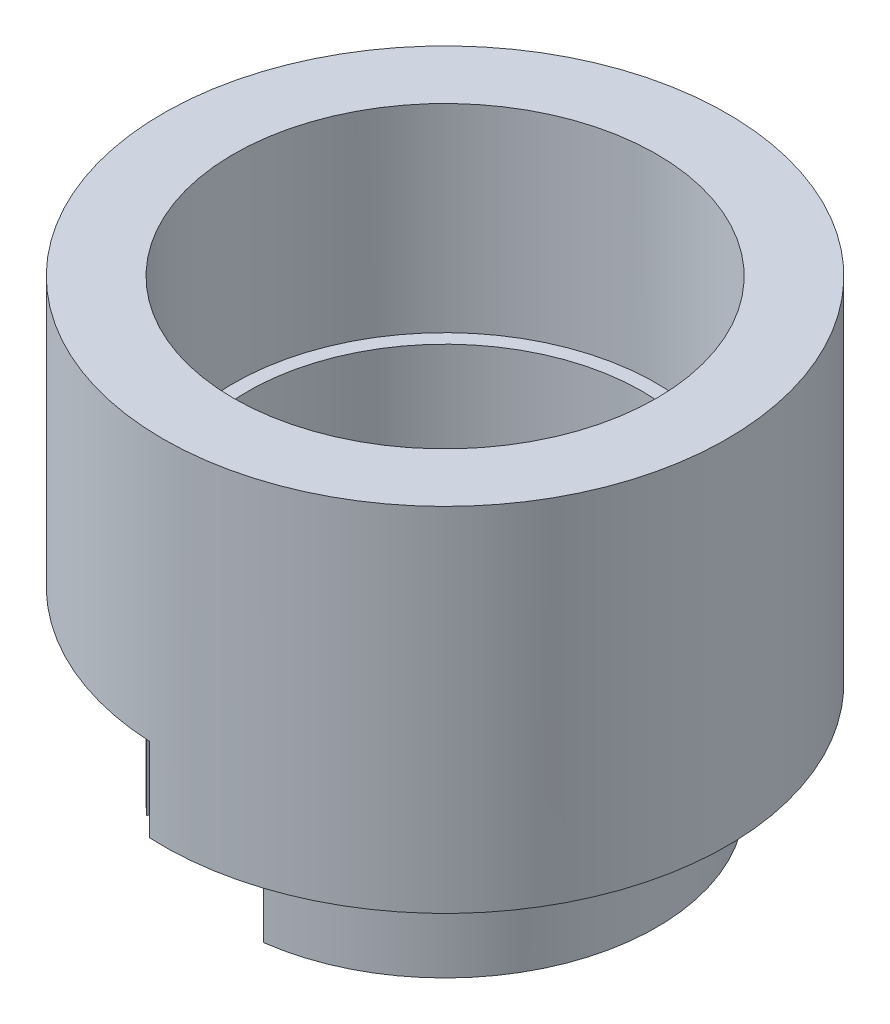
from build123d import *

# Parameters (mm, degrees)
ESBO_O1_R                     = 40
ESBO_O1_R_2                   = 30
RESSALTO_EXTRUS_O1_DEPTH      = 50
ESBO_O2_R                     = 1.5
CORTE_EXTRUS_O1_DEPTH         = 6
CORTE_EXTRUS_O2_DEPTH         = 11.84997677
RESSALTO_EXTRUS_O2_DEPTH      = 26.84997677
RESSALTO_EXTRUS_O2_DEPTH_BACK = 10


with BuildPart() as part:
    # Esboço1 → Ressalto-extrusão1 (new body)
    with BuildSketch(Plane(origin=(0, 0, 0), x_dir=(1, 0, 0), z_dir=(0, 1, 0))):
        with Locations(Location((0, 0, 0), (0, 0, 270))):
            Circle(ESBO_O1_R)
        with Locations(Location((0, 0, 0), (0, 0, 270))):
            Circle(ESBO_O1_R_2, mode=Mode.SUBTRACT)
    extrude(amount=RESSALTO_EXTRUS_O1_DEPTH)

    # Esboço2 → Corte-extrusão1 (cut)
    with BuildSketch(Plane(origin=(0, 0, 0), x_dir=(-1, 0, 0), z_dir=(0, -1, 0))):
        with Locations(Location((-21.160269083, -29.124611797, 0), (0, 0, 90))):
            Circle(ESBO_O2_R)
        with Locations(Location((-34.238034587, -11.124611797, 0), (0, 0, 90))):
            Circle(ESBO_O2_R)
        with Locations(Location((-34.238034587, 11.124611797, 0), (0, 0, 90))):
            Circle(ESBO_O2_R)
        with Locations(Location((21.160269083, 29.124611797, 0), (0, 0, 90))):
            Circle(ESBO_O2_R)
        with Locations(Location((34.238034587, 11.124611797, 0), (0, 0, 90))):
            Circle(ESBO_O2_R)
        with Locations(Location((34.238034587, -11.124611797, 0), (0, 0, 90))):
            Circle(ESBO_O2_R)
    extrude(amount=-CORTE_EXTRUS_O1_DEPTH, mode=Mode.SUBTRACT)

    # Esboço3 → Corte-extrusão2 (cut)
    with BuildSketch(Plane(origin=(0, 0, 0), x_dir=(-1, 0, 0), z_dir=(0, -1, 0))):
        with BuildLine():
            ThreePointArc((30.293924668, -13.087327008), (31.253408489, 10.593604572), (16.092357529, 28.81034587))
            Line((16.092357529, 28.81034587), (19.505887914, 34.921631358))
            ThreePointArc((19.505887914, 34.921631358), (8.030354378, 39.185627576), (-4.197370073, 39.779166463))
            Line((-4.197370073, 39.779166463), (-3.148027555, 29.834374847))
            ThreePointArc((-3.148027555, 29.834374847), (29.911212101, 2.306380417), (1.462902849, -29.964310692))
            Line((1.462902849, -29.964310692), (1.950537132, -39.952414256))
            ThreePointArc((1.950537132, -39.952414256), (22.185986252, -33.283359416), (36.126859334, -17.171197823))
            Line((36.126859334, -17.171197823), (30.293924668, -13.087327008))
        make_face()
    extrude(amount=-CORTE_EXTRUS_O2_DEPTH, mode=Mode.SUBTRACT)

    # Esboço4 → Ressalto-extrusão2 (add, two sides: drawn at the far end of the back side and taken through both)
    with BuildSketch(Plane(origin=(0, 11.84997677, 0), x_dir=(-1, 0, 0), z_dir=(0, -1, 0)).offset(-RESSALTO_EXTRUS_O2_DEPTH_BACK)):
        with BuildLine():
            Line((-4.008838629, -29.730947056), (-4.700362463, -27.602655537))
            ThreePointArc((-4.700362463, -27.602655537), (-8.119302432, 26.79695744), (19.230258499, -20.351834268))
            Line((19.230258499, -20.351834268), (19.909240802, -22.441526924))
            ThreePointArc((19.909240802, -22.441526924), (-8.745833796, 28.696870757), (-4.008838629, -29.730947056))
        make_face()
    extrude(amount=RESSALTO_EXTRUS_O2_DEPTH + RESSALTO_EXTRUS_O2_DEPTH_BACK)


solid = part.part
